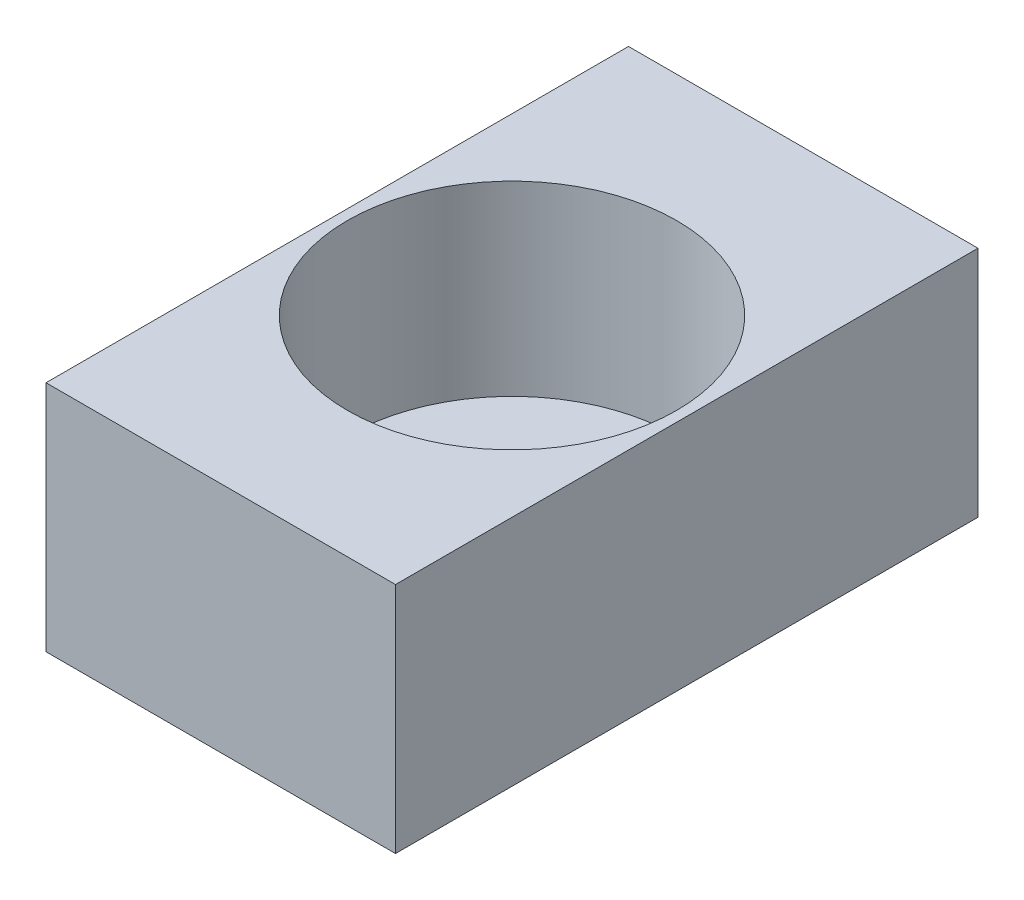
from build123d import *

# Parameters (mm, degrees)
SKETCH2_W           = 30
SKETCH2_H           = 20
BOSS_EXTRUDE1_DEPTH = 50
SKETCH3_R           = 14.125
CUT_EXTRUDE1_DEPTH  = 16
SKETCH4_R           = 3.25
CUT_EXTRUDE2_DEPTH  = 16


with BuildPart() as part:
    # Sketch2 → Boss-Extrude1 (new body)
    with BuildSketch(Plane.XY):
        with Locations((15, 10)):
            Rectangle(SKETCH2_W, SKETCH2_H)
    extrude(amount=BOSS_EXTRUDE1_DEPTH)

    # Sketch3 → Cut-Extrude1 (cut)
    with BuildSketch(Plane(origin=(0, 20, 0), x_dir=(1, 0, 0), z_dir=(0, 1, 0))):
        with Locations(Location((15, -25, 0), (0, 0, 270))):
            Circle(SKETCH3_R)
    extrude(amount=-CUT_EXTRUDE1_DEPTH, mode=Mode.SUBTRACT)

    # Sketch4 → Cut-Extrude2 (cut)
    with BuildSketch(Plane(origin=(0, 4, 0), x_dir=(1, 0, 0), z_dir=(0, 1, 0))):
        with Locations(Location((15, -25, 0), (0, 0, 270))):
            Circle(SKETCH4_R)
    extrude(amount=-CUT_EXTRUDE2_DEPTH, mode=Mode.SUBTRACT)


solid = part.part
